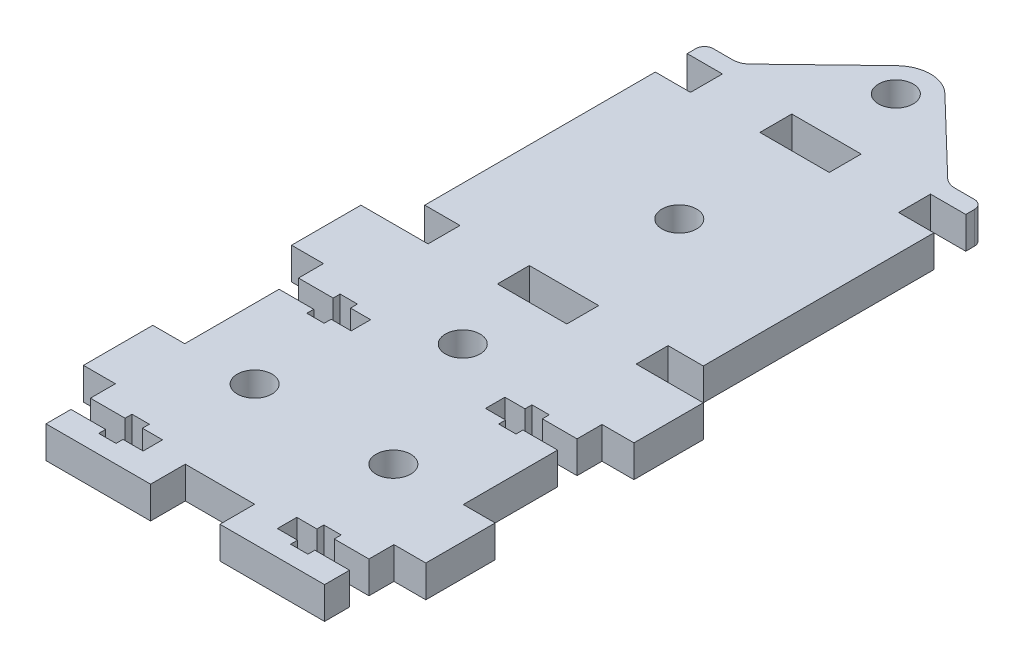
from build123d import *

# Parameters (mm, degrees)
SKETCH1_W           = 12.7
SKETCH1_H           = 5.842
BOSS_EXTRUDE1_DEPTH = 5.842
FILLET1_R           = 1.5875
CUT_EXTRUDE1_DEPTH  = 96.902317244
SKETCH3_R           = 3.175
CUT_EXTRUDE2_DEPTH  = 96.902317244
SKETCH4_R           = 3.175
BOSS_EXTRUDE2_DEPTH = 5.842
FILLET2_R           = 3.175


with BuildPart() as part:
    # Sketch1 → Boss-Extrude1 (new body)
    with BuildSketch(Plane(origin=(0, 0, 0), x_dir=(1, 0, 0), z_dir=(0, 1, 0))):
        Polygon((19.05, -21.1058), (25.5, -21.1058), (25.5, 21.1058), (19.05, 21.1058), (19.05, 26.9478), (25.5, 26.9478), (25.5, 30.1228), (-25.5, 30.1228), (-25.5, 26.9478), (-19.05, 26.9478), (-19.05, 21.1058), (-25.5, 21.1058), (-25.5, -21.1058), (-19.05, -21.1058), (-19.05, -26.9478), (-25.5, -26.9478), (-31.342, -26.9478), (-31.342, -39.6478), (-25.5, -39.6478), (-25.5, -65.0478), (-31.342, -65.0478), (-31.342, -77.7478), (-25.5, -77.7478), (-25.5, -90.4478), (-6.35, -90.4478), (-6.35, -84.0978), (6.35, -84.0978), (6.35, -90.4478), (25.5, -90.4478), (25.5, -77.7478), (31.342, -77.7478), (31.342, -65.0478), (25.5, -65.0478), (25.5, -39.6478), (31.342, -39.6478), (31.342, -26.9478), (25.5, -26.9478), (19.05, -26.9478), align=None)
        with Locations((0, -24.0268)):
            Rectangle(SKETCH1_W, SKETCH1_H, mode=Mode.SUBTRACT)
        with Locations((0, 24.0268)):
            Rectangle(SKETCH1_W, SKETCH1_H, mode=Mode.SUBTRACT)
    extrude(amount=BOSS_EXTRUDE1_DEPTH)

    # Fillet1
    fillet1_edges = [part.edges().sort_by_distance(p)[0] for p in [
        (-25.5, 2.921, -30.1228),
        (25.5, 2.921, -30.1228),
    ]]
    fillet(fillet1_edges, radius=FILLET1_R)

    # Sketch2 → Cut-Extrude1 (cut, through all)
    with BuildSketch(Plane(origin=(0, 5.842, 0), x_dir=(1, 0, 0), z_dir=(0, 1, 0))):
        Polygon((-19.15, -44.2198), (-19.15, -42.9498), (-15.975, -42.9498), (-15.975, -44.2198), (-12.292, -44.2198), (-12.292, -47.7758), (-15.975, -47.7758), (-15.975, -49.0458), (-19.15, -49.0458), (-19.15, -47.7758), (-25.5, -47.7758), (-25.5, -44.2198), align=None)
        Polygon((12.292, -44.2198), (15.975, -44.2198), (15.975, -42.9498), (19.15, -42.9498), (19.15, -44.2198), (25.5, -44.2198), (25.5, -47.7758), (19.15, -47.7758), (19.15, -49.0458), (15.975, -49.0458), (15.975, -47.7758), (12.292, -47.7758), align=None)
        Polygon((19.15, -85.8758), (19.15, -87.1458), (15.975, -87.1458), (15.975, -85.8758), (12.292, -85.8758), (12.292, -82.3198), (15.975, -82.3198), (15.975, -81.0498), (19.15, -81.0498), (19.15, -82.3198), (25.5, -82.3198), (25.5, -85.8758), align=None)
        Polygon((-12.292, -85.8758), (-15.975, -85.8758), (-15.975, -87.1458), (-19.15, -87.1458), (-19.15, -85.8758), (-25.5, -85.8758), (-25.5, -82.3198), (-19.15, -82.3198), (-19.15, -81.0498), (-15.975, -81.0498), (-15.975, -82.3198), (-12.292, -82.3198), align=None)
    extrude(amount=-CUT_EXTRUDE1_DEPTH, mode=Mode.SUBTRACT)

    # Sketch3 → Cut-Extrude2 (cut, through all)
    with BuildSketch(Plane(origin=(0, 5.842, 0), x_dir=(1, 0, 0), z_dir=(0, 1, 0))):
        with Locations(Location((0, 0, 0), (0, 0, 270))):
            Circle(SKETCH3_R)
        with Locations(Location((-12.7, -65.0478, 0), (0, 0, 270))):
            Circle(SKETCH3_R)
        with Locations(Location((12.7, -65.0478, 0), (0, 0, 90))):
            Circle(SKETCH3_R)
        with Locations(Location((0, -39.6478, 0), (0, 0, 270))):
            Circle(SKETCH3_R)
    extrude(amount=-CUT_EXTRUDE2_DEPTH, mode=Mode.SUBTRACT)

    # Sketch4 → Boss-Extrude2 (add)
    with BuildSketch(Plane(origin=(0, 5.842, 0), x_dir=(1, 0, 0), z_dir=(0, 1, 0))):
        with BuildLine():
            Line((-19.05, 30.1228), (-4.403989261, 44.222445188))
            ThreePointArc((-4.403989261, 44.222445188), (0, 45.9978), (4.403989261, 44.222445188))
            Line((4.403989261, 44.222445188), (19.05, 30.1228))
            Line((19.05, 30.1228), (-19.05, 30.1228))
        make_face()
        with Locations(Location((0, 39.6478, 0), (0, 0, 270))):
            Circle(SKETCH4_R, mode=Mode.SUBTRACT)
    extrude(amount=-BOSS_EXTRUDE2_DEPTH)

    # Fillet2
    fillet2_edges = [part.edges().sort_by_distance(p)[0] for p in [
        (-19.05, 2.921, -30.1228),
        (19.05, 2.921, -30.1228),
    ]]
    fillet(fillet2_edges, radius=FILLET2_R)


solid = part.part
